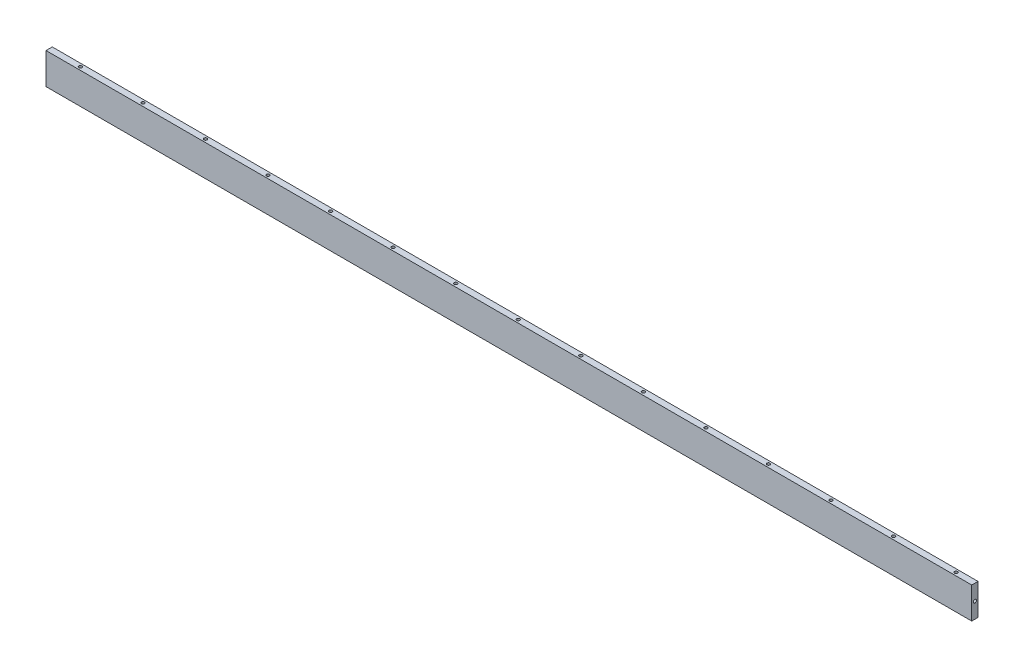
from build123d import *

# Parameters (mm, degrees)
CROQUIS1_W              = 1480
CROQUIS1_H              = 50
SALIENTE_EXTRUIR1_DEPTH = 5
CROQUIS2_R              = 2.5
CORTAR_EXTRUIR1_DEPTH   = 5
CROQUIS3_R              = 2.5
CORTAR_EXTRUIR2_DEPTH   = 5


with BuildPart() as part:
    # Croquis1 → Saliente-Extruir1 (new, symmetric)
    with BuildSketch(Plane.XY):
        Rectangle(CROQUIS1_W, CROQUIS1_H)
    extrude(amount=SALIENTE_EXTRUIR1_DEPTH, both=True)

    # Croquis2 → Cortar-Extruir1 (cut)
    with BuildSketch(Plane(origin=(0, 25, 0), x_dir=(1, 0, 0), z_dir=(0, 1, 0))):
        with Locations(Location((-690, 0, 0), (0, 0, 270))):
            Circle(CROQUIS2_R)
        with Locations(Location((-590, 0, 0), (0, 0, 270))):
            Circle(CROQUIS2_R)
        with Locations(Location((-490, 0, 0), (0, 0, 270))):
            Circle(CROQUIS2_R)
        with Locations(Location((-390, 0, 0), (0, 0, 270))):
            Circle(CROQUIS2_R)
        with Locations(Location((-290, 0, 0), (0, 0, 270))):
            Circle(CROQUIS2_R)
        with Locations(Location((-190, 0, 0), (0, 0, 270))):
            Circle(CROQUIS2_R)
        with Locations(Location((-90, 0, 0), (0, 0, 270))):
            Circle(CROQUIS2_R)
        with Locations(Location((10, 0, 0), (0, 0, 270))):
            Circle(CROQUIS2_R)
        with Locations(Location((110, 0, 0), (0, 0, 270))):
            Circle(CROQUIS2_R)
        with Locations(Location((210, 0, 0), (0, 0, 270))):
            Circle(CROQUIS2_R)
        with Locations(Location((310, 0, 0), (0, 0, 270))):
            Circle(CROQUIS2_R)
        with Locations(Location((410, 0, 0), (0, 0, 270))):
            Circle(CROQUIS2_R)
        with Locations(Location((510, 0, 0), (0, 0, 270))):
            Circle(CROQUIS2_R)
        with Locations(Location((610, 0, 0), (0, 0, 270))):
            Circle(CROQUIS2_R)
        with Locations(Location((710, 0, 0), (0, 0, 270))):
            Circle(CROQUIS2_R)
    extrude(amount=-CORTAR_EXTRUIR1_DEPTH, mode=Mode.SUBTRACT)

    # Croquis3 → Cortar-Extruir2 (cut)
    with BuildSketch(Plane(origin=(740, 0, 0), x_dir=(0, 0, -1), z_dir=(1, 0, 0))):
        Circle(CROQUIS3_R)
    cortar_extruir2 = extrude(amount=-CORTAR_EXTRUIR2_DEPTH, mode=Mode.SUBTRACT)

    # Simetría1: Cortar-Extruir2 across plane
    add(cortar_extruir2.mirror(Plane(origin=(0, 0, 0), x_dir=(0, 0, 1), z_dir=(1, 0, 0))), mode=Mode.SUBTRACT)


solid = part.part
